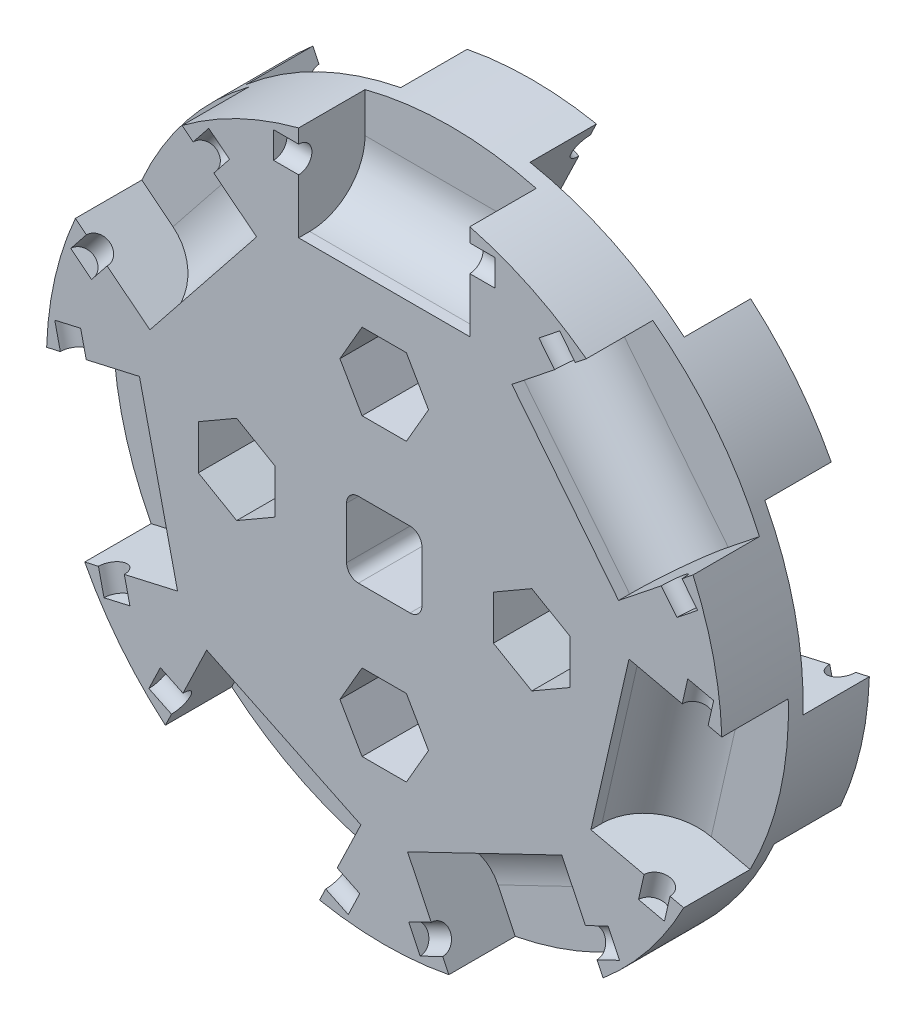
from build123d import *

# Parameters (mm, degrees)
SKETCH1_R           = 29.0703
BOSS_EXTRUDE2_DEPTH = 6.35
SKETCH2_W           = 14.732
SKETCH2_H           = 10.414
CUT_EXTRUDE2_DEPTH  = 5.715
CIRPATTERN1_COUNT   = 7
SKETCH4_R           = 1.143
CUT_EXTRUDE4_DEPTH  = 9.525
CIRPATTERN2_COUNT   = 7
SKETCH5_W           = 6.477
SKETCH5_H           = 6.477
CUT_EXTRUDE5_DEPTH  = 42.599124801
CUT_EXTRUDE7_DEPTH  = 42.599124801
SKETCH9_R           = 29.0703
SKETCH9_W           = 6.477
SKETCH9_H           = 6.477
BOSS_EXTRUDE3_DEPTH = 6.35
CUT_EXTRUDE8_DEPTH  = 5.715
CIRPATTERN3_COUNT   = 7
SKETCH11_R          = 1.143
CUT_EXTRUDE9_DEPTH  = 9.525
CIRPATTERN4_COUNT   = 7
FILLET1_R           = 4.7625
FILLET2_R           = 1.016


with BuildPart() as part:
    # Sketch1 → Boss-Extrude2 (new body)
    with BuildSketch(Plane.XY):
        Circle(SKETCH1_R)
    extrude(amount=-BOSS_EXTRUDE2_DEPTH)

    # Sketch2 → Cut-Extrude2 (cut)
    with BuildSketch(Plane.XY):
        with Locations((0, 25.1333)):
            Rectangle(SKETCH2_W, SKETCH2_H)
    cut_extrude2 = extrude(amount=-CUT_EXTRUDE2_DEPTH, mode=Mode.SUBTRACT)

    # CirPattern1: Cut-Extrude2 ×7 about axis
    cirpattern1_axis = Axis((0, 0, 0), (0, 0, 1))
    for i in range(1, CIRPATTERN1_COUNT):
        add(cut_extrude2.rotate(cirpattern1_axis, i * 360 / CIRPATTERN1_COUNT), mode=Mode.SUBTRACT)

    # Sketch4 → Cut-Extrude4 (cut, symmetric)
    with BuildSketch(Plane(origin=(0, 0, 0), x_dir=(0, 0, -1), z_dir=(1, 0, 0))):
        with Locations((0, 25.7683)):
            Circle(SKETCH4_R)
    cut_extrude4 = extrude(amount=CUT_EXTRUDE4_DEPTH, both=True, mode=Mode.SUBTRACT)

    # CirPattern2: Cut-Extrude4 ×7 about axis
    cirpattern2_axis = Axis((0, 0, 0), (0, 0, 1))
    for i in range(1, CIRPATTERN2_COUNT):
        add(cut_extrude4.rotate(cirpattern2_axis, i * 360 / CIRPATTERN2_COUNT), mode=Mode.SUBTRACT)

    # Sketch5 → Cut-Extrude5 (cut, through all)
    with BuildSketch(Plane.XY):
        Rectangle(SKETCH5_W, SKETCH5_H)
    extrude(amount=-CUT_EXTRUDE5_DEPTH, mode=Mode.SUBTRACT)

    # Sketch6 → Cut-Extrude7 (cut, through all)
    with BuildSketch(Plane(origin=(0, 0, -6.35), x_dir=(-1, 0, 0), z_dir=(0, 0, -1))):
        Polygon((12.7, -3.812821178), (16.002, -1.906410589), (16.002, 1.906410589), (12.7, 3.812821178), (9.398, 1.906410589), (9.398, -1.906410589), align=None)
        Polygon((3.812821178, 12.7), (1.906410589, 16.002), (-1.906410589, 16.002), (-3.812821178, 12.7), (-1.906410589, 9.398), (1.906410589, 9.398), align=None)
        Polygon((-3.812821178, -12.7), (-1.906410589, -16.002), (1.906410589, -16.002), (3.812821178, -12.7), (1.906410589, -9.398), (-1.906410589, -9.398), align=None)
        Polygon((-12.7, 3.812821178), (-16.002, 1.906410589), (-16.002, -1.906410589), (-12.7, -3.812821178), (-9.398, -1.906410589), (-9.398, 1.906410589), align=None)
    extrude(amount=-CUT_EXTRUDE7_DEPTH, mode=Mode.SUBTRACT)

    # Sketch9 → Boss-Extrude3 (add)
    with BuildSketch(Plane(origin=(0, 0, -6.35), x_dir=(-1, 0, 0), z_dir=(0, 0, -1))):
        with Locations(Location((0, 0, 0), (0, 0, 178.179188094))):
            Circle(SKETCH9_R)
        Rectangle(SKETCH9_W, SKETCH9_H, mode=Mode.SUBTRACT)
        Polygon((12.7, -3.812821178), (16.002, -1.906410589), (16.002, 1.906410589), (12.7, 3.812821178), (9.398, 1.906410589), (9.398, -1.906410589), align=None, mode=Mode.SUBTRACT)
        Polygon((3.812821178, 12.7), (1.906410589, 16.002), (-1.906410589, 16.002), (-3.812821178, 12.7), (-1.906410589, 9.398), (1.906410589, 9.398), align=None, mode=Mode.SUBTRACT)
        Polygon((-3.812821178, -12.7), (-1.906410589, -16.002), (1.906410589, -16.002), (3.812821178, -12.7), (1.906410589, -9.398), (-1.906410589, -9.398), align=None, mode=Mode.SUBTRACT)
        Polygon((-12.7, 3.812821178), (-16.002, 1.906410589), (-16.002, -1.906410589), (-12.7, -3.812821178), (-9.398, -1.906410589), (-9.398, 1.906410589), align=None, mode=Mode.SUBTRACT)
    extrude(amount=BOSS_EXTRUDE3_DEPTH)

    # Sketch10 → Cut-Extrude8 (cut)
    with BuildSketch(Plane(origin=(0, 0, -12.7), x_dir=(-1, 0, 0), z_dir=(0, 0, -1))):
        Polygon((-2.009055407, 21.148973594), (-15.282160644, 14.757064537), (-19.800579114, 24.139776859), (-6.527473878, 30.531685916), align=None)
    cut_extrude8 = extrude(amount=-CUT_EXTRUDE8_DEPTH, mode=Mode.SUBTRACT)

    # CirPattern3: Cut-Extrude8 ×7 about axis
    cirpattern3_axis = Axis((0, 0, 0), (0, 0, 1))
    for i in range(1, CIRPATTERN3_COUNT):
        add(cut_extrude8.rotate(cirpattern3_axis, i * 360 / CIRPATTERN3_COUNT), mode=Mode.SUBTRACT)

    # Sketch11 → Cut-Extrude9 (cut, symmetric)
    with BuildSketch(Plane(origin=(0, 0, 0), x_dir=(0, 0, -1), z_dir=(-0.900971031519736, 0.4338792462912495, 0))):
        with Locations((12.7, -25.7683)):
            Circle(SKETCH11_R)
    cut_extrude9 = extrude(amount=CUT_EXTRUDE9_DEPTH, both=True, mode=Mode.SUBTRACT)

    # CirPattern4: Cut-Extrude9 ×7 about axis
    cirpattern4_axis = Axis((0, 0, 0), (0, 0, 1))
    for i in range(1, CIRPATTERN4_COUNT):
        add(cut_extrude9.rotate(cirpattern4_axis, i * 360 / CIRPATTERN4_COUNT), mode=Mode.SUBTRACT)

    # Fillet1
    fillet1_edges = [part.edges().sort_by_distance(p)[0] for p in [
        (-15.579008669, 12.423844839, -5.715),
        (0, 19.9263, -5.715),
        (8.645608025, 17.953019065, -6.985),
        (-8.645787076, 17.952932839, -6.985),
        (-19.426728167, 4.433922012, -6.985),
        (8.645697551, -17.952975952, -5.715),
        (-15.578946715, -12.423922526, -6.985),
        (9.9366e-05, -19.9263, -6.985),
        (15.579070622, -12.423767151, -6.985),
        (19.426683945, 4.434115761, -6.985),
        (19.426706057, -4.434018886, -5.715),
        (-19.426706057, -4.434018886, -5.715),
        (-8.645697551, -17.952975952, -5.715),
        (15.579008669, 12.423844839, -5.715),
    ]]
    fillet(fillet1_edges, radius=FILLET1_R)

    # Fillet2
    fillet2_edges = [part.edges().sort_by_distance(p)[0] for p in [
        (3.2385, 3.2385, -3.175),
        (3.2385, -3.2385, -3.175),
        (-3.2385, -3.2385, -3.175),
        (-3.2385, 3.2385, -3.175),
    ]]
    fillet(fillet2_edges, radius=FILLET2_R)


solid = part.part
